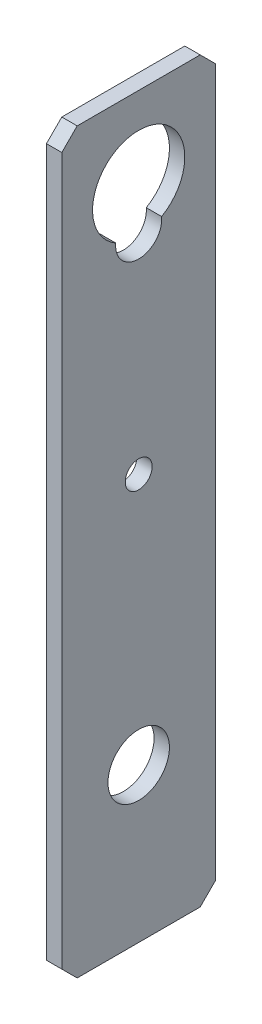
from build123d import *

# Parameters (mm, degrees)
SKETCH1_W           = 20
SKETCH1_H           = 96
BOSS_EXTRUDE1_DEPTH = 2
SKETCH2_R           = 1.75
SKETCH2_R_2         = 4
CUT_EXTRUDE1_DEPTH  = 2
CHAMFER1_SIZE       = 2


with BuildPart() as part:
    # Sketch1 → Boss-Extrude1 (new body)
    with BuildSketch(Plane(origin=(0, 0, 0), x_dir=(0, 0, -1), z_dir=(1, 0, 0))):
        with Locations((10, 48)):
            Rectangle(SKETCH1_W, SKETCH1_H)
    extrude(amount=BOSS_EXTRUDE1_DEPTH)

    # Sketch2 → Cut-Extrude1 (cut)
    with BuildSketch(Plane(origin=(2, 0, 0), x_dir=(0, 0, -1), z_dir=(1, 0, 0))):
        with Locations((10, 52.75)):
            Circle(SKETCH2_R)
        with Locations((10, 20)):
            Circle(SKETCH2_R_2)
        with BuildLine():
            ThreePointArc((12.985415651, 80.295454545), (10, 91.5), (7.014584349, 80.295454545))
            ThreePointArc((7.014584349, 80.295454545), (10, 77), (12.985415651, 80.295454545))
        make_face()
    extrude(amount=-CUT_EXTRUDE1_DEPTH, mode=Mode.SUBTRACT)

    # Chamfer1
    chamfer1_edges = [part.edges().sort_by_distance(p)[0] for p in [
        (1, 96, 0),
        (1, 96, -20),
        (1, 0, -20),
        (1, 0, 0),
    ]]
    chamfer(chamfer1_edges, length=CHAMFER1_SIZE)


solid = part.part
